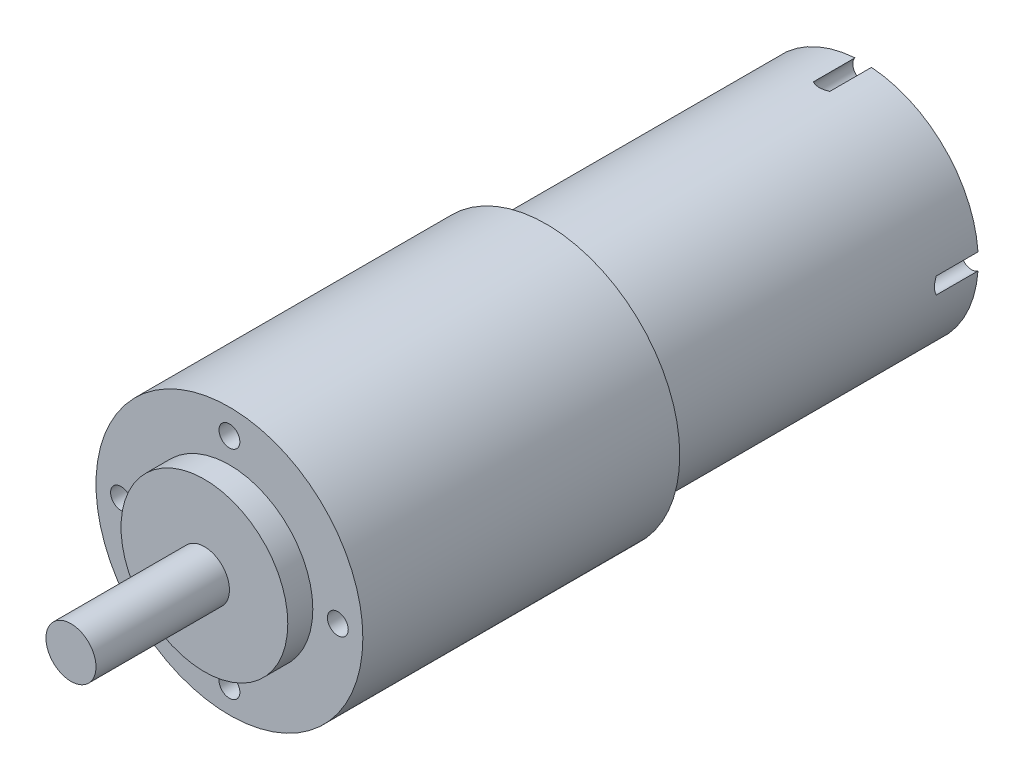
from build123d import *

# Parameters (mm, degrees)
SKETCH1_R                   = 16
BOSS_EXTRUDE1_DEPTH         = 38
SKETCH2_R                   = 13.8
BOSS_EXTRUDE2_DEPTH         = 38
SKETCH3_R                   = 5
BOSS_EXTRUDE3_DEPTH         = 2
SKETCH4_R                   = 10
BOSS_EXTRUDE4_DEPTH         = 3
SKETCH5_R                   = 3
BOSS_EXTRUDE5_DEPTH         = 16
TAP_DRILL_FOR_M3_TAP1_D     = 2.5
TAP_DRILL_FOR_M3_TAP1_DEPTH = 5
TAP_DRILL_FOR_M3_TAP1_TIP   = 0.751075774
TAP_DRILL_FOR_M3_TAP2_D     = 2.5
TAP_DRILL_FOR_M3_TAP2_DEPTH = 5
TAP_DRILL_FOR_M3_TAP2_TIP   = 0.751075774


with BuildPart() as part:
    # Sketch1 → Boss-Extrude1 (new body)
    with BuildSketch(Plane.XY):
        Circle(SKETCH1_R)
    extrude(amount=BOSS_EXTRUDE1_DEPTH)

    # Sketch2 → Boss-Extrude2 (add)
    with BuildSketch(Plane(origin=(0, 0, 0), x_dir=(-1, 0, 0), z_dir=(0, 0, -1))):
        Circle(SKETCH2_R)
    extrude(amount=BOSS_EXTRUDE2_DEPTH)

    # Sketch3 → Boss-Extrude3 (add)
    with BuildSketch(Plane(origin=(0, 0, -38), x_dir=(-1, 0, 0), z_dir=(0, 0, -1))):
        Circle(SKETCH3_R)
    extrude(amount=BOSS_EXTRUDE3_DEPTH)

    # Sketch4 → Boss-Extrude4 (add)
    with BuildSketch(Plane.XY.offset(38)):
        Circle(SKETCH4_R)
    extrude(amount=BOSS_EXTRUDE4_DEPTH)

    # Sketch5 → Boss-Extrude5 (add)
    with BuildSketch(Plane.XY.offset(41)):
        Circle(SKETCH5_R)
    extrude(amount=BOSS_EXTRUDE5_DEPTH)

    # Tap Drill for M3 Tap1
    with Locations(Plane(origin=(0, 0, -38), x_dir=(-1, 0, 0), z_dir=(0, 0, -1))):
        with Locations((-13, 0), (0, -13), (13, 0), (0, 13)):
            Hole(TAP_DRILL_FOR_M3_TAP1_D / 2, depth=TAP_DRILL_FOR_M3_TAP1_DEPTH)
            with Locations((0, 0, -(TAP_DRILL_FOR_M3_TAP1_DEPTH + TAP_DRILL_FOR_M3_TAP1_TIP / 2))):  # 118° drill point
                Cone(0, TAP_DRILL_FOR_M3_TAP1_D / 2, TAP_DRILL_FOR_M3_TAP1_TIP, mode=Mode.SUBTRACT)

    # Tap Drill for M3 Tap2
    with Locations(Plane.XY.offset(38)):
        with Locations((0, 13), (-13, 0), (0, -13), (13, 0)):
            Hole(TAP_DRILL_FOR_M3_TAP2_D / 2, depth=TAP_DRILL_FOR_M3_TAP2_DEPTH)
            with Locations((0, 0, -(TAP_DRILL_FOR_M3_TAP2_DEPTH + TAP_DRILL_FOR_M3_TAP2_TIP / 2))):  # 118° drill point
                Cone(0, TAP_DRILL_FOR_M3_TAP2_D / 2, TAP_DRILL_FOR_M3_TAP2_TIP, mode=Mode.SUBTRACT)


solid = part.part
